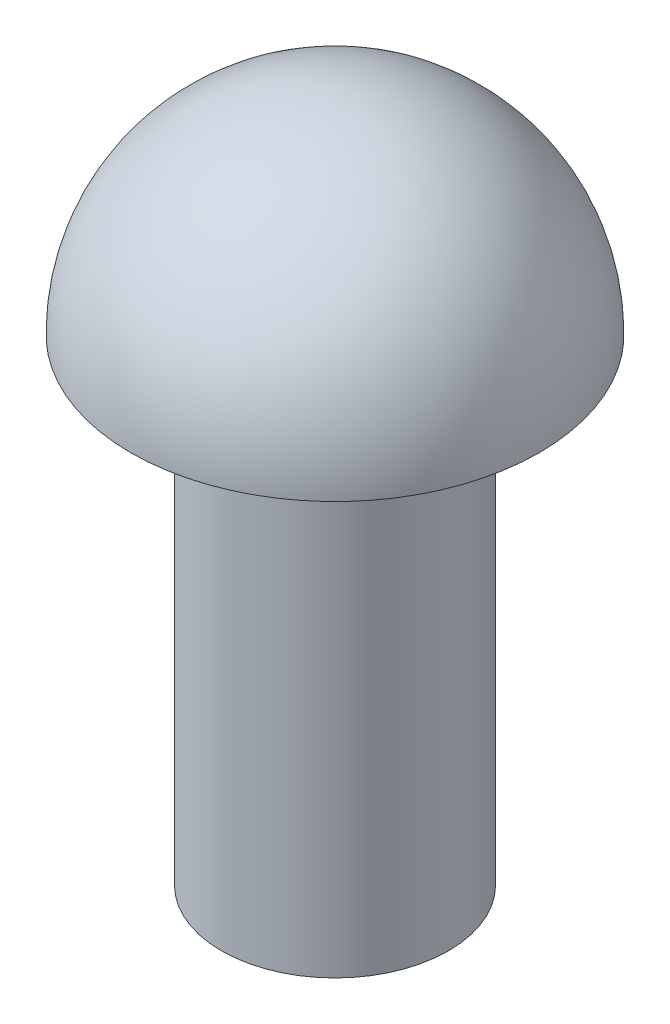
from build123d import *

# Parameters (mm, degrees)
SKETCH1_R           = 5
BOSS_EXTRUDE1_DEPTH = 21


with BuildPart() as part:
    # Sketch1 → Boss-Extrude1 (new body)
    with BuildSketch(Plane(origin=(0, 0, 0), x_dir=(1, 0, 0), z_dir=(0, 1, 0))):
        with Locations(Location((0, 0, 0), (0, 0, 270))):
            Circle(SKETCH1_R)
    extrude(amount=-BOSS_EXTRUDE1_DEPTH)

    # Sketch2 → Revolve1 (revolve)
    with BuildSketch(Plane.XY):
        with BuildLine():
            Line((9, 0), (0, 0))
            Line((0, 0), (0, 9))
            ThreePointArc((0, 9), (6.363961031, 6.363961031), (9, 0))
        make_face()
    revolve(axis=Axis((0, 9, 0), (0, -1, 0)))


solid = part.part
